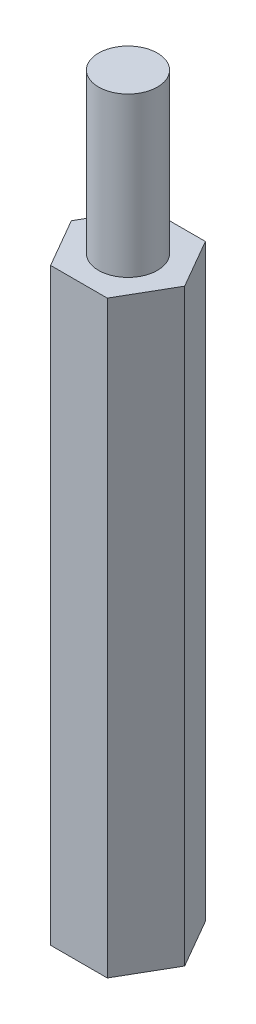
from build123d import *

# Parameters (mm, degrees)
BOSS_EXTRUDE1_DEPTH = 30
SKETCH5_R           = 1.5
BOSS_EXTRUDE2_DEPTH = 8.091605471
SKETCH5_2_R         = 1.5
BOSS_EXTRUDE3_DEPTH = 8


with BuildPart() as part:
    # Sketch3 → Boss-Extrude1 (new body)
    with BuildSketch(Plane(origin=(0, 0, 0), x_dir=(1, 0, 0), z_dir=(0, 1, 0))):
        Polygon((-2.886751346, 0), (-1.443375673, -2.5), (1.443375673, -2.5), (2.886751346, 0), (1.443375673, 2.5), (-1.443375673, 2.5), align=None)
    extrude(amount=BOSS_EXTRUDE1_DEPTH)

    # Sketch5 → Boss-Extrude2 (add)
    with BuildSketch(Plane(origin=(0, 30, 0), x_dir=(1, 0, 0), z_dir=(0, 1, 0))):
        Circle(SKETCH5_R)
    extrude(amount=BOSS_EXTRUDE2_DEPTH)

    # Sketch5<2> → Boss-Extrude3 (add)
    with BuildSketch(Plane(origin=(0, 30, 0), x_dir=(1, 0, 0), z_dir=(0, 1, 0))):
        Circle(SKETCH5_2_R)
    extrude(amount=BOSS_EXTRUDE3_DEPTH)


solid = part.part
